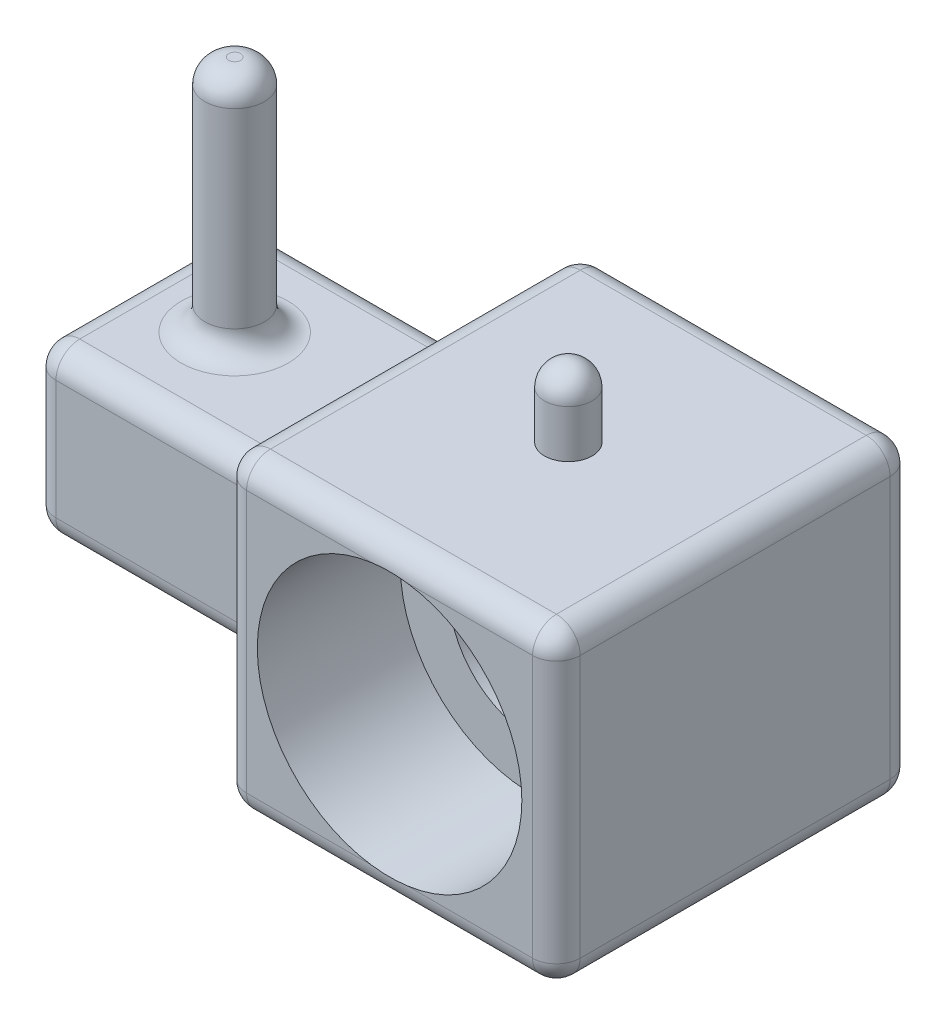
from build123d import *

# Parameters (mm, degrees)
CROQUIS1_W              = 14
CROQUIS1_H              = 13
CROQUIS1_R              = 3.5
SALIENTE_EXTRUIR1_DEPTH = 15
CROQUIS3_R              = 1
SALIENTE_EXTRUIR2_DEPTH = 3
REDONDEO2_R             = 1
SALIENTE_EXTRUIR3_START = 3
CROQUIS4_R              = 1
SALIENTE_EXTRUIR3_DEPTH = 3
REDONDEO3_R             = 1
REDONDEO4_R             = 1
CROQUIS5_W              = 9
CROQUIS5_H              = 7
SALIENTE_EXTRUIR4_DEPTH = 11
REDONDEO5_R             = 1
CROQUIS6_R              = 1.24838436
SALIENTE_EXTRUIR5_DEPTH = 10
REDONDEO6_R             = 1
CROQUIS2_R              = 5.55
CORTAR_EXTRUIR2_DEPTH   = 6


with BuildPart() as part:
    # Croquis1 → Saliente-Extruir1 (new body)
    with BuildSketch(Plane.XY):
        Rectangle(CROQUIS1_W, CROQUIS1_H)
        Circle(CROQUIS1_R, mode=Mode.SUBTRACT)
    extrude(amount=-SALIENTE_EXTRUIR1_DEPTH)

    # Croquis3 → Saliente-Extruir2 (add)
    with BuildSketch(Plane(origin=(0, 6.5, 0), x_dir=(1, 0, 0), z_dir=(0, 1, 0))):
        with Locations(Location((0, 7.5, 0), (0, 0, 180))):
            Circle(CROQUIS3_R)
    extrude(amount=SALIENTE_EXTRUIR2_DEPTH)

    # Redondeo2
    redondeo2_edges = [part.edges().sort_by_distance(p)[0] for p in [
        (1, 9.5, -7.5),
    ]]
    fillet(redondeo2_edges, radius=REDONDEO2_R)

    # Croquis4 → Saliente-Extruir3 (add)
    with BuildSketch(Plane.XZ.offset(6.5).offset(SALIENTE_EXTRUIR3_START)):
        with Locations((0, -7.5)):
            Circle(CROQUIS4_R)
    extrude(amount=-SALIENTE_EXTRUIR3_DEPTH)

    # Redondeo3
    redondeo3_edges = [part.edges().sort_by_distance(p)[0] for p in [
        (-1, -6.5, -7.5),
        (-1, -9.5, -7.5),
    ]]
    fillet(redondeo3_edges, radius=REDONDEO3_R)

    # Redondeo4
    redondeo4_edges = [part.edges().sort_by_distance(p)[0] for p in [
        (7, 0, -15),
        (0, 6.5, -15),
        (-7, 0, -15),
        (0, 6.5, 0),
        (7, 0, 0),
        (0, -6.5, 0),
        (-7, 0, 0),
        (-7, 6.5, -7.5),
        (7, 6.5, -7.5),
        (7, -6.5, -7.5),
        (-7, -6.5, -7.5),
        (0, -6.5, -15),
    ]]
    fillet(redondeo4_edges, radius=REDONDEO4_R)

    # Croquis5 → Saliente-Extruir4 (add)
    with BuildSketch(Plane.ZY.offset(7)):
        with Locations((-7.5, 0)):
            Rectangle(CROQUIS5_W, CROQUIS5_H)
    extrude(amount=SALIENTE_EXTRUIR4_DEPTH)

    # Redondeo5
    redondeo5_edges = [part.edges().sort_by_distance(p)[0] for p in [
        (-7, 0, -12),
        (-12.5, 3.5, -12),
        (-7, -3.5, -7.5),
        (-12.5, -3.5, -12),
        (-7, 0, -3),
        (-12.5, -3.5, -3),
        (-7, 3.5, -7.5),
        (-12.5, 3.5, -3),
        (-18, 0, -12),
        (-18, -3.5, -7.5),
        (-18, 0, -3),
        (-18, 3.5, -7.5),
    ]]
    fillet(redondeo5_edges, radius=REDONDEO5_R)

    # Croquis6 → Saliente-Extruir5 (add)
    with BuildSketch(Plane(origin=(0, 3.5, 0), x_dir=(1, 0, 0), z_dir=(0, 1, 0))):
        with Locations((-14, 7.5)):
            Circle(CROQUIS6_R)
    extrude(amount=SALIENTE_EXTRUIR5_DEPTH)

    # Redondeo6
    redondeo6_edges = [part.edges().sort_by_distance(p)[0] for p in [
        (-15.24838436, 3.5, -7.5),
        (-15.24838436, 13.5, -7.5),
    ]]
    fillet(redondeo6_edges, radius=REDONDEO6_R)

    # Croquis2 → Cortar-Extruir2 (cut)
    with BuildSketch(Plane(origin=(0, 0, 0), x_dir=(-1, 0, 0), z_dir=(0, 0, -1))):
        with Locations(Location((0, 0, 0), (0, 0, 97.696667542))):
            Circle(CROQUIS2_R)
    extrude(amount=CORTAR_EXTRUIR2_DEPTH, mode=Mode.SUBTRACT)


solid = part.part
